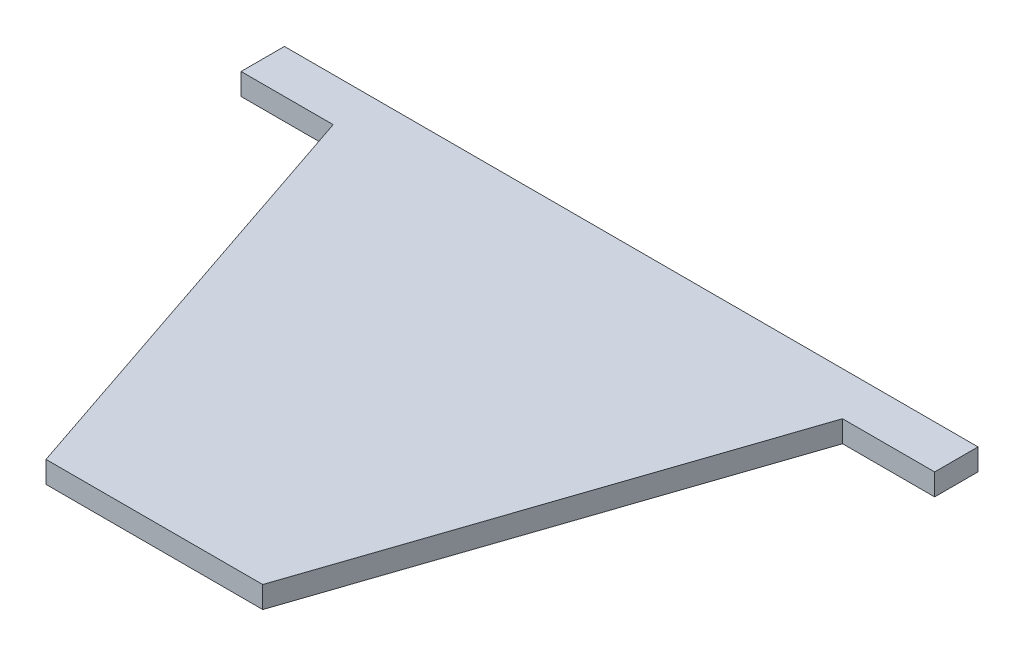
from build123d import *

# Parameters (mm, degrees)
BOSS_EXTRU_1_DEPTH = 6.35


with BuildPart() as part:
    # Esquisse1 → Boss.-Extru.1 (new body)
    with BuildSketch(Plane(origin=(0, 0, 0), x_dir=(1, 0, 0), z_dir=(0, 1, 0))):
        Polygon((-101.6, 139.7), (-101.6, 127), (-74.6125, 127), (-31.75, 0), (31.75, 0), (74.6125, 127), (101.6, 127), (101.6, 139.7), align=None)
    extrude(amount=BOSS_EXTRU_1_DEPTH)


solid = part.part
